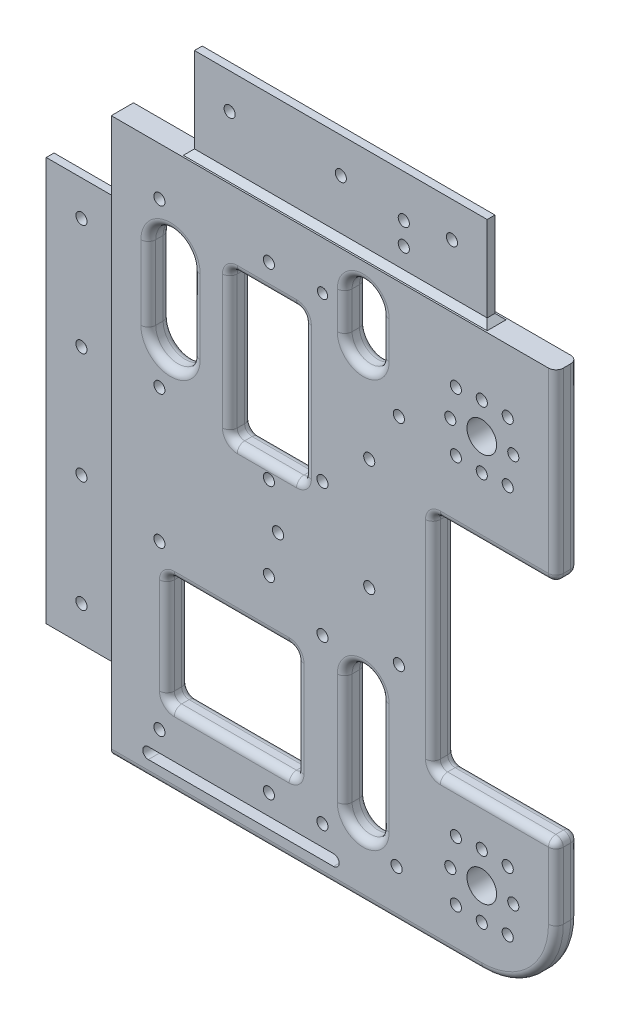
from build123d import *

# Parameters (mm, degrees)
SKETCH_1_W             = 120
SKETCH_1_H             = 150
EXTRUDE_305_DEPTH      = 3
SKETCH_3_W             = 2.1
SKETCH_3_H             = 109
EXTRUDE_516_DEPTH      = 19.5
SKETCH_2_W             = 79
SKETCH_2_H             = 2.1
EXTRUDE_686_DEPTH      = 24.5
SKETCH_4_W             = 33.2
SKETCH_4_H             = 60
CUT_EXTRUDE_1179_DEPTH = 10
SKETCH_6_R             = 1.5
SKETCH_6_R_2           = 1.500000003
CUT_EXTRUDE_1778_DEPTH = 5
SKETCH_13_R            = 1.5
CUT_EXTRUDE_2105_DEPTH = 10
SKETCH_9_R             = 1.5
CUT_EXTRUDE_2636_DEPTH = 10
SKETCH_8_R             = 1.5
SKETCH_8_R_2           = 1.370584527
SKETCH_8_R_3           = 1.48277709
CUT_EXTRUDE_3212_DEPTH = 10
SKETCH_16_R            = 1.5
CUT_EXTRUDE_4021_DEPTH = 10
CUT_EXTRUDE_4898_DEPTH = 10
SKETCH_11_R            = 5
SKETCH_11_W            = 10
SKETCH_11_H            = 10
SKETCH_11_H_2          = 30
CUT_EXTRUDE_6160_DEPTH = 10
SKETCH_19_W            = 35
SKETCH_19_H            = 30
SKETCH_19_W_2          = 20
SKETCH_19_H_2          = 40
CUT_EXTRUDE_7435_DEPTH = 10
SKETCH_14_R            = 4
SKETCH_14_R_2          = 1.5
CUT_EXTRUDE_1_DEPTH    = 10
SKETCH_15_R            = 4
SKETCH_15_R_2          = 1.5
CUT_EXTRUDE_2_DEPTH    = 10
SKETCH_18_R            = 1.5
CUT_EXTRUDE_1_2_DEPTH  = 10
SKETCH_17_R            = 1.5
CUT_EXTRUDE_2_2_DEPTH  = 10
SKETCH_21_R            = 1.5
CUT_EXTRUDE_9667_DEPTH = 10
CHAMFER_9744_SIZE      = 1.5
CHAMFER_9866_SIZE      = 1.5
FILLET_9950_R          = 2
FILLET_11584_R         = 2
FILLET_12350_R         = 20
FILLET_12419_R         = 2


with BuildPart() as part:
    # 草图1 → Extrude 305 (new, symmetric)
    with BuildSketch(Plane.XY):
        Rectangle(SKETCH_1_W, SKETCH_1_H)
    extrude(amount=EXTRUDE_305_DEPTH, both=True)

    # 草图3 → Extrude 516 (add)
    with BuildSketch(Plane.ZY.offset(60)):
        Rectangle(SKETCH_3_W, SKETCH_3_H)
    extrude(amount=EXTRUDE_516_DEPTH)

    # 草图2 → Extrude 686 (add)
    with BuildSketch(Plane(origin=(0, 75, 0), x_dir=(1, 0, 0), z_dir=(0, 1, 0))):
        Rectangle(SKETCH_2_W, SKETCH_2_H)
    extrude(amount=EXTRUDE_686_DEPTH)

    # 草图4 → Cut-Extrude 1179 (cut)
    with BuildSketch(Plane.XY.offset(3)):
        with Locations((43.4, -5)):
            Rectangle(SKETCH_4_W, SKETCH_4_H)
    extrude(amount=-CUT_EXTRUDE_1179_DEPTH, mode=Mode.SUBTRACT)

    # 草图6 → Cut-Extrude 1778 (cut)
    with BuildSketch(Plane.XY.offset(3)):
        with Locations(Location((-70, 45, 0), (0, 0, 270))):
            Circle(SKETCH_6_R)
        with Locations(Location((-70, 15, 0), (0, 0, 270))):
            Circle(SKETCH_6_R)
        with Locations(Location((-70, -15, 0), (0, 0, 270))):
            Circle(SKETCH_6_R)
        with Locations(Location((-70, -45, 0), (0, 0, 270))):
            Circle(SKETCH_6_R_2)
    extrude(amount=-CUT_EXTRUDE_1778_DEPTH, mode=Mode.SUBTRACT)

    # 草图13 → Cut-Extrude 2105 (cut)
    with BuildSketch(Plane.XY.offset(1.05)):
        with Locations((-30, 90)):
            Circle(SKETCH_13_R)
        with Locations((0, 90)):
            Circle(SKETCH_13_R)
        with Locations((30, 90)):
            Circle(SKETCH_13_R)
    extrude(amount=-CUT_EXTRUDE_2105_DEPTH, mode=Mode.SUBTRACT)

    # 草图9 → Cut-Extrude 2636 (cut)
    with BuildSketch(Plane.XY.offset(3)):
        with Locations((-17.455, 62)):
            Circle(SKETCH_9_R)
        with Locations((-17.455, 11.2)):
            Circle(SKETCH_9_R)
        with Locations((-17.455, -11.2)):
            Circle(SKETCH_9_R)
        with Locations((-17.455, -62)):
            Circle(SKETCH_9_R)
    extrude(amount=-CUT_EXTRUDE_2636_DEPTH, mode=Mode.SUBTRACT)

    # 草图8 → Cut-Extrude 3212 (cut)
    with BuildSketch(Plane.XY.offset(3)):
        with Locations((-47, 62)):
            Circle(SKETCH_8_R)
        with Locations((-3, 62)):
            Circle(SKETCH_8_R_2)
        with Locations((-47, 18)):
            Circle(SKETCH_8_R_3)
        with Locations((-3, 18)):
            Circle(SKETCH_8_R)
        with Locations((-47, -62)):
            Circle(SKETCH_8_R)
        with Locations((-47, -18)):
            Circle(SKETCH_8_R)
        with Locations((-3, -18)):
            Circle(SKETCH_8_R)
        with Locations((-3, -62)):
            Circle(SKETCH_8_R)
    extrude(amount=-CUT_EXTRUDE_3212_DEPTH, mode=Mode.SUBTRACT)

    # 草图16 → Cut-Extrude 4021 (cut)
    with BuildSketch(Plane.XY.offset(3)):
        with Locations((17.62, 43.5)):
            Circle(SKETCH_16_R)
        with Locations((9.62, 29.5)):
            Circle(SKETCH_16_R)
        with Locations((9.62, -0.5)):
            Circle(SKETCH_16_R)
        with Locations((17.62, -14.5)):
            Circle(SKETCH_16_R)
    extrude(amount=-CUT_EXTRUDE_4021_DEPTH, mode=Mode.SUBTRACT)

    # 草图10 → Cut-Extrude 4898 (cut)
    with BuildSketch(Plane.XY.offset(3)):
        with BuildLine():
            ThreePointArc((-48.5, -69), (-48.939339828, -70.060660172), (-50, -70.5))
            Line((-50, -70.5), (0, -70.5))
            ThreePointArc((0, -70.5), (-1.5, -69), (0, -67.5))
            Line((0, -67.5), (-50, -67.5))
            ThreePointArc((-50, -67.5), (-48.939339828, -67.939339828), (-48.5, -69))
        make_face()
        with BuildLine():
            ThreePointArc((-50, -67.5), (-51.5, -69), (-50, -70.5))
            Line((-50, -70.5), (-50, -67.5))
        make_face()
        with BuildLine():
            Line((-50, -67.5), (-50, -70.5))
            ThreePointArc((-50, -70.5), (-48.939339828, -70.060660172), (-48.5, -69))
            ThreePointArc((-48.5, -69), (-48.939339828, -67.939339828), (-50, -67.5))
        make_face()
        with BuildLine():
            ThreePointArc((0, -67.5), (-1.5, -69), (0, -70.5))
            Line((0, -70.5), (0, -67.5))
        make_face()
        with BuildLine():
            Line((0, -67.5), (0, -70.5))
            ThreePointArc((0, -70.5), (1.060660172, -70.060660172), (1.5, -69))
            ThreePointArc((1.5, -69), (1.060660172, -67.939339828), (0, -67.5))
        make_face()
    extrude(amount=-CUT_EXTRUDE_4898_DEPTH, mode=Mode.SUBTRACT)

    # 草图11 → Cut-Extrude 6160 (cut)
    with BuildSketch(Plane.XY.offset(3)):
        with Locations((8, -55)):
            Circle(SKETCH_11_R)
        with Locations((8, 65)):
            Circle(SKETCH_11_R)
        with Locations((8, 55)):
            Circle(SKETCH_11_R)
        with Locations((8, -25)):
            Circle(SKETCH_11_R)
        with Locations((8, 60)):
            Rectangle(SKETCH_11_W, SKETCH_11_H)
        with Locations((8, -40)):
            Rectangle(SKETCH_11_W, SKETCH_11_H_2)
    extrude(amount=-CUT_EXTRUDE_6160_DEPTH, mode=Mode.SUBTRACT)

    # 草图19 → Cut-Extrude 7435 (cut)
    with BuildSketch(Plane.XY.offset(3)):
        with BuildLine():
            ThreePointArc((-38, 50), (-44, 56), (-50, 50))
            Line((-50, 50), (-50, 30))
            ThreePointArc((-50, 30), (-44, 24), (-38, 30))
            Line((-38, 30), (-38, 50))
        make_face()
        with Locations((-27.5, -40)):
            Rectangle(SKETCH_19_W, SKETCH_19_H)
        with Locations((-18, 35)):
            Rectangle(SKETCH_19_W_2, SKETCH_19_H_2)
    extrude(amount=-CUT_EXTRUDE_7435_DEPTH, mode=Mode.SUBTRACT)

    # 草图14 → Cut-Extrude 1 (cut)
    with BuildSketch(Plane.XY.offset(3)):
        with Locations((40, 50)):
            Circle(SKETCH_14_R)
        with Locations((48.5, 50)):
            Circle(SKETCH_14_R_2)
        with Locations((40, 41.5)):
            Circle(SKETCH_14_R_2)
        with Locations((31.5, 50)):
            Circle(SKETCH_14_R_2)
        with Locations((40, 58.5)):
            Circle(SKETCH_14_R_2)
        with Locations((33, 58)):
            Circle(SKETCH_14_R_2)
        with Locations((47, 58)):
            Circle(SKETCH_14_R_2)
        with Locations((33, 42)):
            Circle(SKETCH_14_R_2)
        with Locations((47, 42)):
            Circle(SKETCH_14_R_2)
    extrude(amount=-CUT_EXTRUDE_1_DEPTH, mode=Mode.SUBTRACT)

    # 草图15 → Cut-Extrude 2 (cut)
    with BuildSketch(Plane.XY.offset(3)):
        with Locations((40, -55)):
            Circle(SKETCH_15_R)
        with Locations((48.5, -55)):
            Circle(SKETCH_15_R_2)
        with Locations((31.5, -55)):
            Circle(SKETCH_15_R_2)
        with Locations((40, -46.5)):
            Circle(SKETCH_15_R_2)
        with Locations((40, -63.55)):
            Circle(SKETCH_15_R_2)
        with Locations((33, -63)):
            Circle(SKETCH_15_R_2)
        with Locations((47, -47)):
            Circle(SKETCH_15_R_2)
        with Locations((33, -47)):
            Circle(SKETCH_15_R_2)
        with Locations((47, -63)):
            Circle(SKETCH_15_R_2)
    extrude(amount=-CUT_EXTRUDE_2_DEPTH, mode=Mode.SUBTRACT)

    # 草图18 → Cut-Extrude 1 2 (cut)
    with BuildSketch(Plane.XY.offset(1.05)):
        with Locations((17, 82)):
            Circle(SKETCH_18_R)
        with Locations((17, 88)):
            Circle(SKETCH_18_R)
    extrude(amount=-CUT_EXTRUDE_1_2_DEPTH, mode=Mode.SUBTRACT)

    # 草图17 → Cut-Extrude 2 2 (cut)
    with BuildSketch(Plane.XY.offset(3)):
        with Locations((17, -62)):
            Circle(SKETCH_17_R)
    extrude(amount=-CUT_EXTRUDE_2_2_DEPTH, mode=Mode.SUBTRACT)

    # 草图21 → Cut-Extrude 9667 (cut)
    with BuildSketch(Plane.XY.offset(3)):
        with Locations((-15, 0)):
            Circle(SKETCH_21_R)
    extrude(amount=-CUT_EXTRUDE_9667_DEPTH, mode=Mode.SUBTRACT)

    # Chamfer 9744
    chamfer_9744_edges = [part.edges().sort_by_distance(p)[0] for p in [
        (-60, 0, 1.05),
        (-60, 54.5, 0),
        (-60, 0, -1.05),
        (-60, -54.5, 0),
    ]]
    chamfer(chamfer_9744_edges, length=CHAMFER_9744_SIZE)

    # Chamfer 9866
    chamfer_9866_edges = [part.edges().sort_by_distance(p)[0] for p in [
        (39.5, 75, 0),
        (0, 75, -1.05),
        (-39.5, 75, 0),
        (0, 75, 1.05),
    ]]
    chamfer(chamfer_9866_edges, length=CHAMFER_9866_SIZE)

    # Fillet 9950
    fillet_9950_edges = [part.edges().sort_by_distance(p)[0] for p in [
        (-27.5, -55, -3),
        (-27.5, -55, 3),
        (-45, -40, -3),
        (-45, -55, 0),
        (-45, -40, 3),
        (-50, 40, -3),
        (-50, 40, 3),
        (-10, -40, -3),
        (-10, -40, 3),
        (-10, -55, 0),
        (-38, 40, -3),
        (-38, 40, 3),
        (-27.5, -25, -3),
        (-45, -25, 0),
        (-27.5, -25, 3),
        (-10, -25, 0),
        (-18, 15, 3),
        (-18, 15, -3),
        (-28, 55, 0),
        (-8, 15, 0),
        (-28, 35, -3),
        (-28, 15, 0),
        (-28, 35, 3),
        (-18, 55, 3),
        (-18, 55, -3),
        (-8, 55, 0),
        (-8, 35, 3),
        (-8, 35, -3),
        (-44, 56, -3),
        (-44, 24, -3),
        (-44, 56, 3),
        (-44, 24, 3),
    ]]
    fillet(fillet_9950_edges, radius=FILLET_9950_R)

    # Fillet 11584
    fillet_11584_edges = [part.edges().sort_by_distance(p)[0] for p in [
        (3, 60, -3),
        (8, 50, -3),
        (8, 70, -3),
        (13, 60, -3),
        (3, -40, -3),
        (8, -60, -3),
        (13, -40, -3),
        (8, -20, -3),
        (13, -40, 3),
        (8, -20, 3),
        (3, -40, 3),
        (8, -60, 3),
        (13, 60, 3),
        (3, 60, 3),
        (8, 50, 3),
        (8, 70, 3),
    ]]
    fillet(fillet_11584_edges, radius=FILLET_11584_R)

    # Fillet 12350
    fillet_12350_edges = [part.edges().sort_by_distance(p)[0] for p in [
        (60, -75, 0),
    ]]
    fillet(fillet_12350_edges, radius=FILLET_12350_R)

    # Fillet 12419
    fillet_12419_edges = [part.edges().sort_by_distance(p)[0] for p in [
        (-10, -75, 3),
        (60, 50, -3),
        (43.4, -35, -3),
        (26.8, -5, -3),
        (43.4, 25, -3),
        (60, 50, 3),
        (26.8, -35, 0),
        (26.8, 25, 0),
        (60, 25, 0),
        (60, -35, 0),
        (26.8, -5, 3),
        (43.4, -35, 3),
        (43.4, 25, 3),
        (-10, -75, -3),
        (60, -45, -3),
        (60, -45, 3),
        (54.142135624, -69.142135624, -3),
        (54.142135624, -69.142135624, 3),
    ]]
    fillet(fillet_12419_edges, radius=FILLET_12419_R)


solid = part.part
